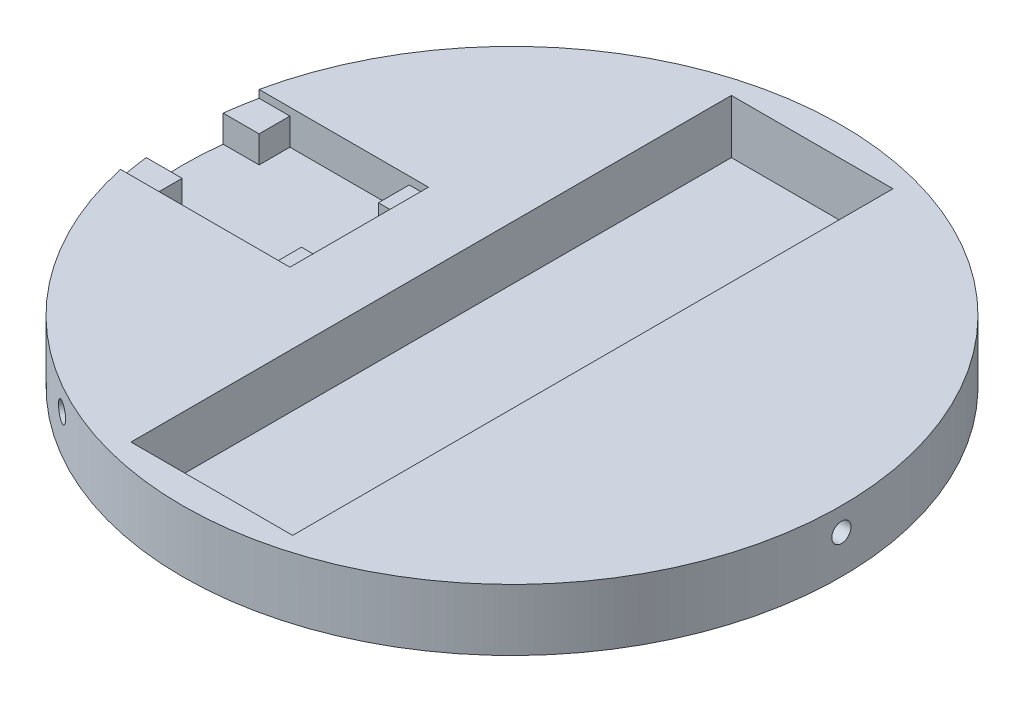
from build123d import *

# Parameters (mm, degrees)
SKETCH1_R           = 42.81
BOSS_EXTRUDE1_DEPTH = 1
BOSS_EXTRUDE2_START = 7
BOSS_EXTRUDE2_DEPTH = 7
SKETCH2_W           = 2.5
SKETCH2_H           = 4
CUT_EXTRUDE1_DEPTH  = 1
CUT_EXTRUDE2_DEPTH  = 4.5
BOSS_EXTRUDE3_START = 7
BOSS_EXTRUDE3_DEPTH = 7
SKETCH4_R           = 1.25
CUT_EXTRUDE3_DEPTH  = 11
CIRPATTERN1_COUNT   = 3


with BuildPart() as part:
    # Sketch1 → Boss-Extrude1 (new body)
    with BuildSketch(Plane(origin=(0, 0, 0), x_dir=(1, 0, 0), z_dir=(0, 1, 0))):
        Circle(SKETCH1_R)
    extrude(amount=-BOSS_EXTRUDE1_DEPTH)

    # Sketch1<3> → Boss-Extrude2 (add)
    with BuildSketch(Plane(origin=(0, 0, 0), x_dir=(1, 0, 0), z_dir=(0, 1, 0)).offset(BOSS_EXTRUDE2_START)):
        with BuildLine():
            ThreePointArc((-10.5, 41.502362583), (-42.81, 0), (-10.5, -41.502362583))
            Line((-10.5, -41.502362583), (-10.5, 41.502362583))
        make_face()
        with BuildLine():
            Line((10.5, 41.502362583), (10.5, -41.502362583))
            ThreePointArc((10.5, -41.502362583), (42.81, 0), (10.5, 41.502362583))
        make_face()
    extrude(amount=-BOSS_EXTRUDE2_DEPTH)

    # Sketch2 → Cut-Extrude1 (cut)
    with BuildSketch(Plane(origin=(0, 7, 0), x_dir=(1, 0, 0), z_dir=(0, 1, 0))):
        with BuildLine():
            Line((-37.85326869, 9), (-41.85326869, 9))
            ThreePointArc((-41.85326869, 9), (-42.232522563, 7.007862583), (-42.517009537, 5))
            Line((-42.517009537, 5), (-37.85326869, 5))
            Line((-37.85326869, 5), (-37.85326869, 9))
        make_face()
        with Locations((-21.10326869, 7)):
            Rectangle(SKETCH2_W, SKETCH2_H)
        with BuildLine():
            Line((-37.85326869, -5), (-42.517009537, -5))
            ThreePointArc((-42.517009537, -5), (-42.232522563, -7.007862583), (-41.85326869, -9))
            Line((-41.85326869, -9), (-37.85326869, -9))
            Line((-37.85326869, -9), (-37.85326869, -5))
        make_face()
        with Locations((-21.10326869, -7)):
            Rectangle(SKETCH2_W, SKETCH2_H)
    extrude(amount=-CUT_EXTRUDE1_DEPTH, mode=Mode.SUBTRACT)

    # Sketch2<3> → Cut-Extrude2 (cut)
    with BuildSketch(Plane(origin=(0, 7, 0), x_dir=(1, 0, 0), z_dir=(0, 1, 0))):
        with BuildLine():
            Line((-22.35326869, 9), (-37.85326869, 9))
            Line((-37.85326869, 9), (-37.85326869, 5))
            Line((-37.85326869, 5), (-42.517009537, 5))
            ThreePointArc((-42.517009537, 5), (-42.81, 0), (-42.517009537, -5))
            Line((-42.517009537, -5), (-37.85326869, -5))
            Line((-37.85326869, -5), (-37.85326869, -9))
            Line((-37.85326869, -9), (-22.35326869, -9))
            Line((-22.35326869, -9), (-22.35326869, -5))
            Line((-22.35326869, -5), (-19.85326869, -5))
            Line((-19.85326869, -5), (-19.85326869, 5))
            Line((-19.85326869, 5), (-22.35326869, 5))
            Line((-22.35326869, 5), (-22.35326869, 9))
        make_face()
    extrude(amount=-CUT_EXTRUDE2_DEPTH, mode=Mode.SUBTRACT)

    # Sketch3 → Boss-Extrude3 (add)
    with BuildSketch(Plane(origin=(0, 0, 0), x_dir=(1, 0, 0), z_dir=(0, 1, 0)).offset(BOSS_EXTRUDE3_START)):
        with BuildLine():
            Line((-10.5, 41.502362583), (-10.5, 39))
            Line((-10.5, 39), (10.5, 39))
            Line((10.5, 39), (10.5, 41.502362583))
            ThreePointArc((10.5, 41.502362583), (0, 42.81), (-10.5, 41.502362583))
        make_face()
        with BuildLine():
            Line((10.5, -39), (-10.5, -39))
            Line((-10.5, -39), (-10.5, -41.502362583))
            ThreePointArc((-10.5, -41.502362583), (0, -42.81), (10.5, -41.502362583))
            Line((10.5, -41.502362583), (10.5, -39))
        make_face()
    extrude(amount=-BOSS_EXTRUDE3_DEPTH)

    # Sketch4 → Cut-Extrude3 (cut)
    with BuildSketch(Plane(origin=(42.81, 0, 0), x_dir=(0, 0, -1), z_dir=(1, 0, 0))):
        with Locations((0, 4)):
            Circle(SKETCH4_R)
    cut_extrude3 = extrude(amount=-CUT_EXTRUDE3_DEPTH, mode=Mode.SUBTRACT)

    # CirPattern1: Cut-Extrude3 ×3 about axis
    cirpattern1_axis = Axis((0, 7, 0), (0, 1, 0))
    for i in range(1, CIRPATTERN1_COUNT):
        add(cut_extrude3.rotate(cirpattern1_axis, i * 360 / CIRPATTERN1_COUNT), mode=Mode.SUBTRACT)


solid = part.part
